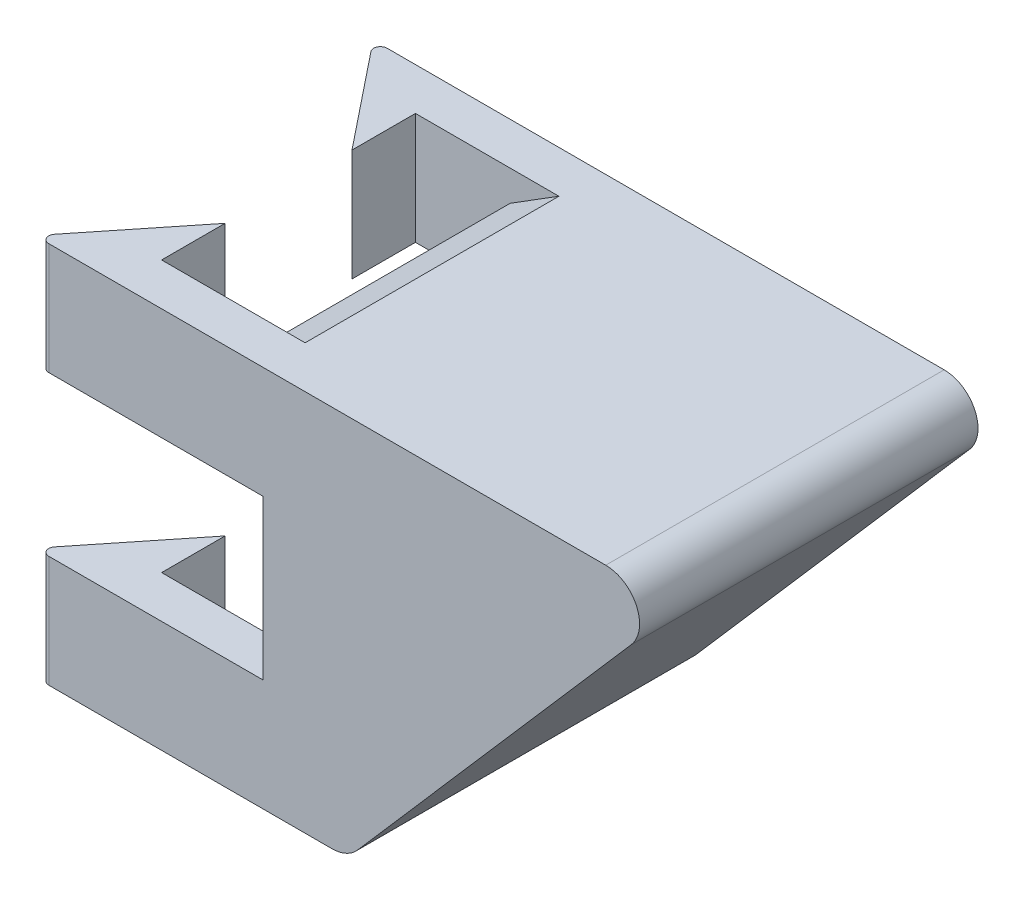
from build123d import *

# Parameters (mm, degrees)
BOSS_EXTRUDE1_DEPTH           = 12.7
SKETCH3_W                     = 9.525
SKETCH3_H                     = 3.683
BOSS_EXTRUDE2_DEPTH           = 1.2573
BOSS_EXTRUDE2_DRAFT           = 24.44
BOSS_EXTRUDE2_PROFILE_2_DEPTH = 1.2573
BOSS_EXTRUDE2_PROFILE_2_DRAFT = 24.44
BOSS_EXTRUDE2_PROFILE_3_DEPTH = 1.2573
BOSS_EXTRUDE2_PROFILE_3_DRAFT = 24.44
SKETCH2_W                     = 1.5875
SKETCH2_H                     = 4.191
BOSS_EXTRUDE3_DEPTH           = 5.3848
SKETCH4_W                     = 3.96875
SKETCH4_H                     = 4.191
BOSS_EXTRUDE4_DEPTH           = 3.175
CUT_EXTRUDE1_START            = -14.351
CUT_EXTRUDE1_DEPTH            = 14.351
FILLET1_R                     = 0.254


with BuildPart() as part:
    # Sketch1 → Boss-Extrude1 (new body)
    with BuildSketch(Plane.XY):
        with BuildLine():
            Line((3.554693097, 0.436578304), (13.826745412, 12.247578304))
            ThreePointArc((13.826745412, 12.247578304), (14.024174489, 13.607523715), (12.868461386, 14.351))
            Line((12.868461386, 14.351), (0, 14.351))
            Line((0, 14.351), (0, 0))
            Line((0, 0), (2.596409071, 0))
            ThreePointArc((2.596409071, 0), (3.122932786, 0.114286897), (3.554693097, 0.436578304))
        make_face()
    extrude(amount=BOSS_EXTRUDE1_DEPTH)


with BuildPart() as boss_extrude2_tool:
    # Sketch3 → Boss-Extrude2 (with draft: the straight prism first)
    with BuildSketch(Plane.ZY):
        with Locations((6.35, 7.1755)):
            Rectangle(SKETCH3_W, SKETCH3_H)
    extrude(amount=BOSS_EXTRUDE2_DEPTH)
    # Boss-Extrude2: the draft: its side faces are tilted about the plane it starts from
    boss_extrude2_sides = [boss_extrude2_tool.faces().sort_by_distance(p)[0] for p in [
        (-0.62865, 7.1755, 1.5875),
        (-0.62865, 5.334, 6.35),
        (-0.62865, 7.1755, 11.1125),
        (-0.62865, 9.017, 6.35),
    ]]
    draft(boss_extrude2_sides, Plane.ZY, BOSS_EXTRUDE2_DRAFT)


with BuildPart() as part_1:
    add(part.part)

    # Boss-Extrude2: add boss_extrude2_tool
    add(boss_extrude2_tool.part)


with BuildPart() as boss_extrude2_profile_2_tool:
    # Sketch3 → Boss-Extrude2 profile 2 (with draft: the straight prism first)
    with BuildSketch(Plane.ZY):
        with Locations((6.35, 12.5095)):
            Rectangle(SKETCH3_W, SKETCH3_H)
    extrude(amount=BOSS_EXTRUDE2_PROFILE_2_DEPTH)
    # Boss-Extrude2 profile 2: the draft: its side faces are tilted about the plane it starts from
    boss_extrude2_profile_2_sides = [boss_extrude2_profile_2_tool.faces().sort_by_distance(p)[0] for p in [
        (-0.62865, 12.5095, 1.5875),
        (-0.62865, 10.668, 6.35),
        (-0.62865, 12.5095, 11.1125),
        (-0.62865, 14.351, 6.35),
    ]]
    draft(boss_extrude2_profile_2_sides, Plane.ZY, BOSS_EXTRUDE2_PROFILE_2_DRAFT)


with BuildPart() as part_2:
    add(part_1.part)

    # Boss-Extrude2 profile 2: add boss_extrude2_profile_2_tool
    add(boss_extrude2_profile_2_tool.part)


with BuildPart() as boss_extrude2_profile_3_tool:
    # Sketch3 → Boss-Extrude2 profile 3 (with draft: the straight prism first)
    with BuildSketch(Plane.ZY):
        with Locations((6.35, 1.8415)):
            Rectangle(SKETCH3_W, SKETCH3_H)
    extrude(amount=BOSS_EXTRUDE2_PROFILE_3_DEPTH)
    # Boss-Extrude2 profile 3: the draft: its side faces are tilted about the plane it starts from
    boss_extrude2_profile_3_sides = [boss_extrude2_profile_3_tool.faces().sort_by_distance(p)[0] for p in [
        (-0.62865, 1.8415, 1.5875),
        (-0.62865, 0, 6.35),
        (-0.62865, 1.8415, 11.1125),
        (-0.62865, 3.683, 6.35),
    ]]
    draft(boss_extrude2_profile_3_sides, Plane.ZY, BOSS_EXTRUDE2_PROFILE_3_DRAFT)


with BuildPart() as part_3:
    add(part_2.part)

    # Boss-Extrude2 profile 3: add boss_extrude2_profile_3_tool
    add(boss_extrude2_profile_3_tool.part)

    # Sketch2 → Boss-Extrude3 (add)
    with BuildSketch(Plane.ZY):
        with Locations((0.79375, 12.2555)):
            Rectangle(SKETCH2_W, SKETCH2_H)
        with Locations((0.79375, 2.0955)):
            Rectangle(SKETCH2_W, SKETCH2_H)
        with Locations((11.90625, 2.0955)):
            Rectangle(SKETCH2_W, SKETCH2_H)
        with Locations((11.90625, 12.2555)):
            Rectangle(SKETCH2_W, SKETCH2_H)
    extrude(amount=BOSS_EXTRUDE3_DEPTH)

    # Sketch4 → Boss-Extrude4 (add)
    with BuildSketch(Plane.ZY.offset(5.3848)):
        with Locations((1.984375, 12.2555)):
            Rectangle(SKETCH4_W, SKETCH4_H)
        with Locations((10.715625, 12.2555)):
            Rectangle(SKETCH4_W, SKETCH4_H)
        with Locations((10.715625, 2.0955)):
            Rectangle(SKETCH4_W, SKETCH4_H)
        with Locations((1.984375, 2.0955)):
            Rectangle(SKETCH4_W, SKETCH4_H)
    extrude(amount=BOSS_EXTRUDE4_DEPTH)

    # Sketch5 → Cut-Extrude1 (cut)
    with BuildSketch(Plane.XZ.offset(CUT_EXTRUDE1_START)):
        Polygon((-5.3848, 3.96875), (-8.5598, 0), (-8.5598, 3.96875), align=None)
        Polygon((-8.5598, 12.7), (-8.5598, 8.73125), (-5.3848, 8.73125), align=None)
    extrude(amount=CUT_EXTRUDE1_DEPTH, mode=Mode.SUBTRACT)

    # Fillet1
    fillet1_edges = [part_3.edges().sort_by_distance(p)[0] for p in [
        (-8.5598, 12.2555, 0),
        (-8.5598, 2.0955, 12.7),
        (-8.5598, 12.2555, 12.7),
        (-8.5598, 2.0955, 0),
    ]]
    fillet(fillet1_edges, radius=FILLET1_R)


solid = part_3.part
